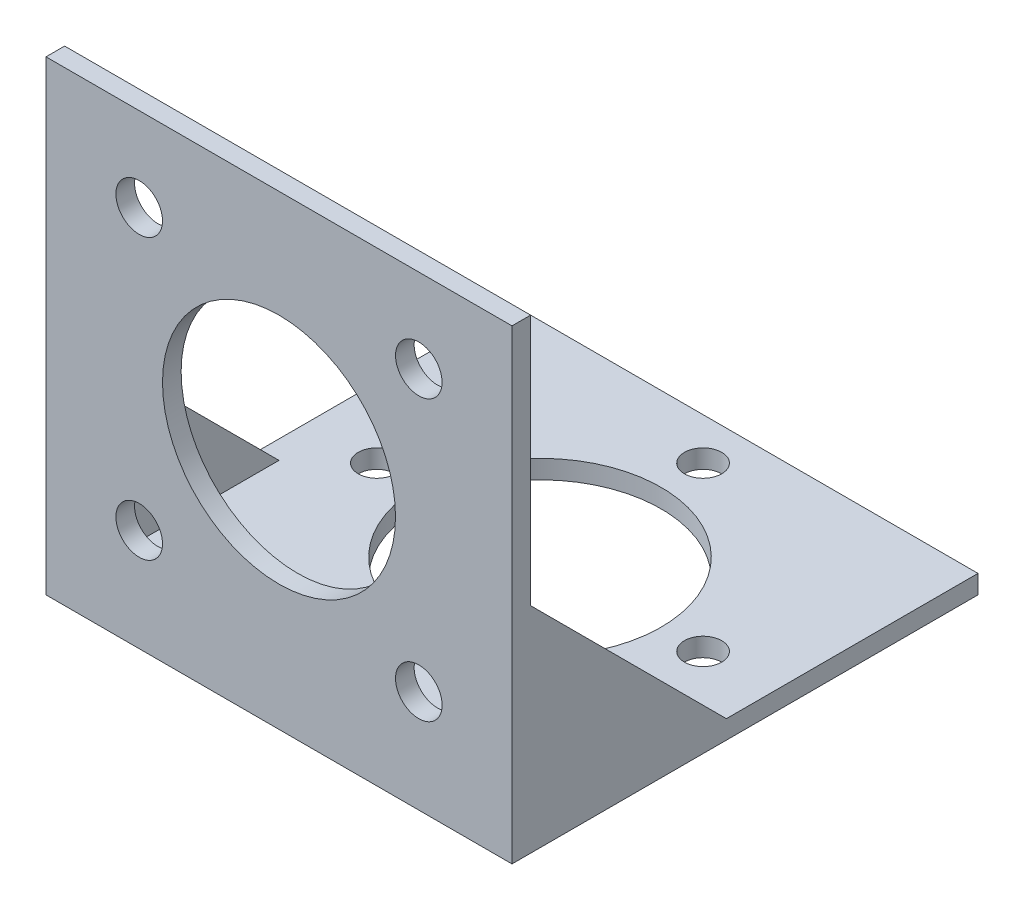
from build123d import *

# Parameters (mm, degrees)
SKETCH_1_W      = 50
SKETCH_1_H      = 50
SKETCH_1_R      = 13
SKETCH_1_R_2    = 2
EXTRUDE_1_DEPTH = 2
SKETCH_2_W      = 50
SKETCH_2_H      = 50
SKETCH_2_R      = 12.5
SKETCH_2_R_2    = 2.5
EXTRUDE_2_DEPTH = 2
EXTRUDE_3_DEPTH = 2


with BuildPart() as part:
    # 草图1 → 凸台-拉伸1 (new body)
    with BuildSketch(Plane(origin=(0, 0, 0), x_dir=(1, 0, 0), z_dir=(0, 1, 0))):
        Rectangle(SKETCH_1_W, SKETCH_1_H)
        with Locations(Location((0, 3, 0), (0, 0, 270))):
            Circle(SKETCH_1_R, mode=Mode.SUBTRACT)
        with Locations(Location((0, 20.5, 0), (0, 0, 270))):
            Circle(SKETCH_1_R_2, mode=Mode.SUBTRACT)
        with Locations(Location((0, -14.5, 0), (0, 0, 270))):
            Circle(SKETCH_1_R_2, mode=Mode.SUBTRACT)
        with Locations(Location((17.5, 3, 0), (0, 0, 270))):
            Circle(SKETCH_1_R_2, mode=Mode.SUBTRACT)
        with Locations(Location((-17.5, 3, 0), (0, 0, 270))):
            Circle(SKETCH_1_R_2, mode=Mode.SUBTRACT)
    extrude(amount=EXTRUDE_1_DEPTH)

    # 草图2 → 凸台-拉伸2 (add)
    with BuildSketch(Plane.XY.offset(25)):
        with Locations((0, 25)):
            Rectangle(SKETCH_2_W, SKETCH_2_H)
        with Locations((0, 26)):
            Circle(SKETCH_2_R, mode=Mode.SUBTRACT)
        with Locations((-15, 41)):
            Circle(SKETCH_2_R_2, mode=Mode.SUBTRACT)
        with Locations((15, 41)):
            Circle(SKETCH_2_R_2, mode=Mode.SUBTRACT)
        with Locations((15, 11)):
            Circle(SKETCH_2_R_2, mode=Mode.SUBTRACT)
        with Locations((-15, 11)):
            Circle(SKETCH_2_R_2, mode=Mode.SUBTRACT)
    extrude(amount=-EXTRUDE_2_DEPTH)

    # 草图3 → 凸台-拉伸3 (add)
    with BuildSketch(Plane(origin=(25, 0, 0), x_dir=(0, 0, -1), z_dir=(1, 0, 0))):
        Polygon((-25, 0), (0, 0), (-25, 25), align=None)
    extrude_3 = extrude(amount=-EXTRUDE_3_DEPTH)

    # 镜向2: 凸台-拉伸3 across plane
    add(extrude_3.mirror(Plane(origin=(0, 0, 0), x_dir=(0, 0, 1), z_dir=(1, 0, 0))))


solid = part.part
